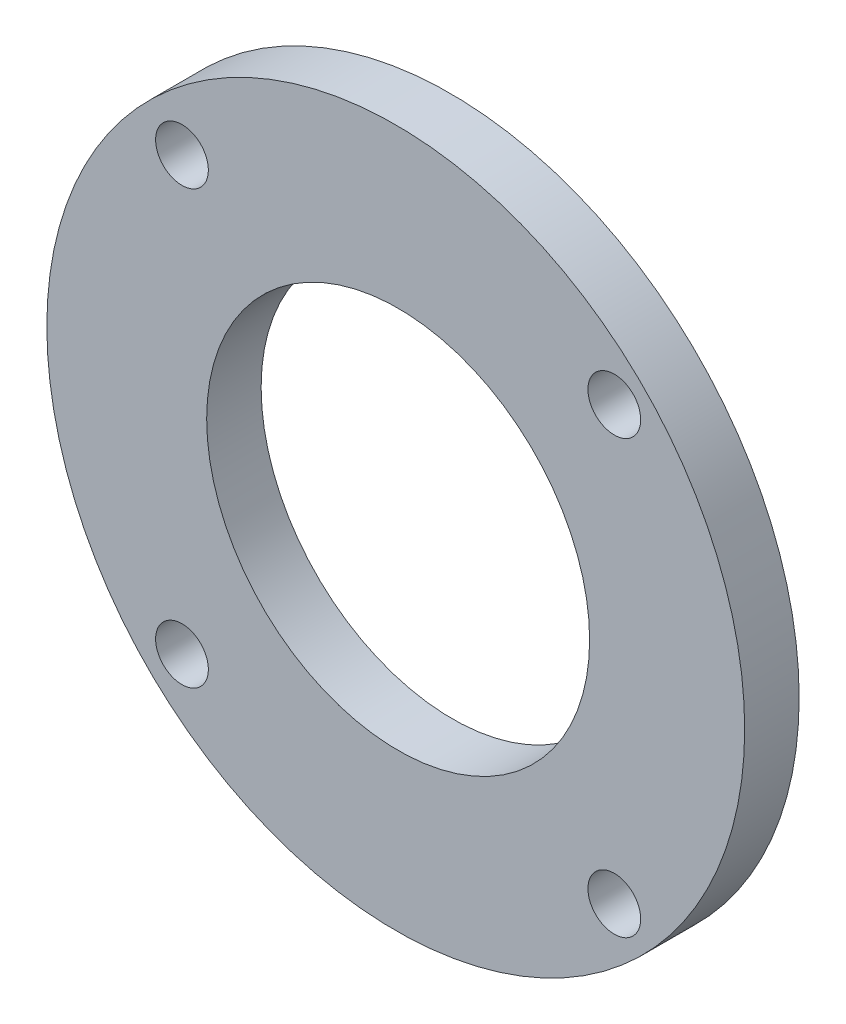
from build123d import *

# Parameters (mm, degrees)
SKETCH1_R          = 20.5
EXTRUDE1_DEPTH     = 3.2
SKETCH2_R          = 11.25
CUT_EXTRUDE1_DEPTH = 61.417603842
SKETCH3_R          = 1.55
CUT_EXTRUDE2_DEPTH = 61.417603842


with BuildPart() as part:
    # Sketch1 → Extrude1 (new body)
    with BuildSketch(Plane.XY):
        with Locations((22.085163637, 22.23816435)):
            Circle(SKETCH1_R)
    extrude(amount=EXTRUDE1_DEPTH)

    # Sketch2 → Cut-Extrude1 (cut, through all)
    with BuildSketch(Plane.XY.offset(3.2)):
        with Locations((22.225, 22.225)):
            Circle(SKETCH2_R)
    extrude(amount=-CUT_EXTRUDE1_DEPTH, mode=Mode.SUBTRACT)

    # Sketch3 → Cut-Extrude2 (cut, through all)
    with BuildSketch(Plane.XY.offset(3.2)):
        with Locations((34.925, 34.925)):
            Circle(SKETCH3_R)
        with Locations((9.525, 34.925)):
            Circle(SKETCH3_R)
        with Locations((34.925, 9.525)):
            Circle(SKETCH3_R)
        with Locations((9.525, 9.525)):
            Circle(SKETCH3_R)
    extrude(amount=-CUT_EXTRUDE2_DEPTH, mode=Mode.SUBTRACT)


solid = part.part
